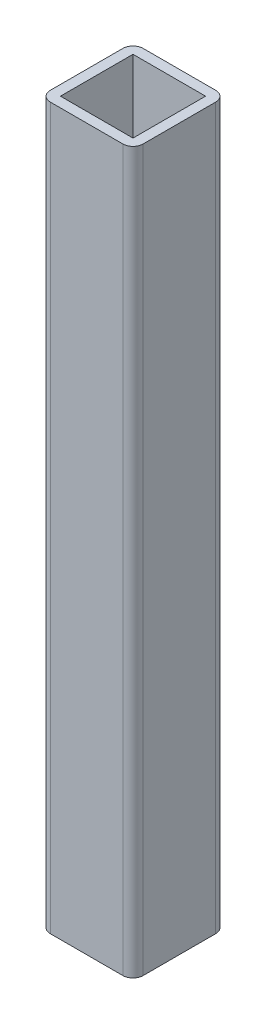
from build123d import *

# Parameters (mm, degrees)
BOSS_EXTRUDE1_DEPTH = 198.5
SKETCH3_W           = 20
SKETCH3_H           = 20
CUT_EXTRUDE1_DEPTH  = 861


with BuildPart() as part:
    # Sketch1 → Boss-Extrude1 (new body)
    with BuildSketch(Plane(origin=(0, 0, 0), x_dir=(1, 0, 0), z_dir=(0, 1, 0))):
        with BuildLine():
            Line((2.8, 0), (22.8, 0))
            ThreePointArc((22.8, 0), (24.779898987, -0.820101013), (25.6, -2.8))
            Line((25.6, -2.8), (25.6, -22.8))
            ThreePointArc((25.6, -22.8), (24.779898987, -24.779898987), (22.8, -25.6))
            Line((22.8, -25.6), (2.8, -25.6))
            ThreePointArc((2.8, -25.6), (0.820101013, -24.779898987), (0, -22.8))
            Line((0, -22.8), (0, -2.8))
            ThreePointArc((0, -2.8), (0.820101013, -0.820101013), (2.8, 0))
        make_face()
    extrude(amount=BOSS_EXTRUDE1_DEPTH)

    # Sketch3 → Cut-Extrude1 (cut)
    with BuildSketch(Plane(origin=(0, 0, 0), x_dir=(-1, 0, 0), z_dir=(0, -1, 0))):
        with Locations((-12.8, -12.8)):
            Rectangle(SKETCH3_W, SKETCH3_H)
    extrude(amount=-CUT_EXTRUDE1_DEPTH, mode=Mode.SUBTRACT)


solid = part.part
